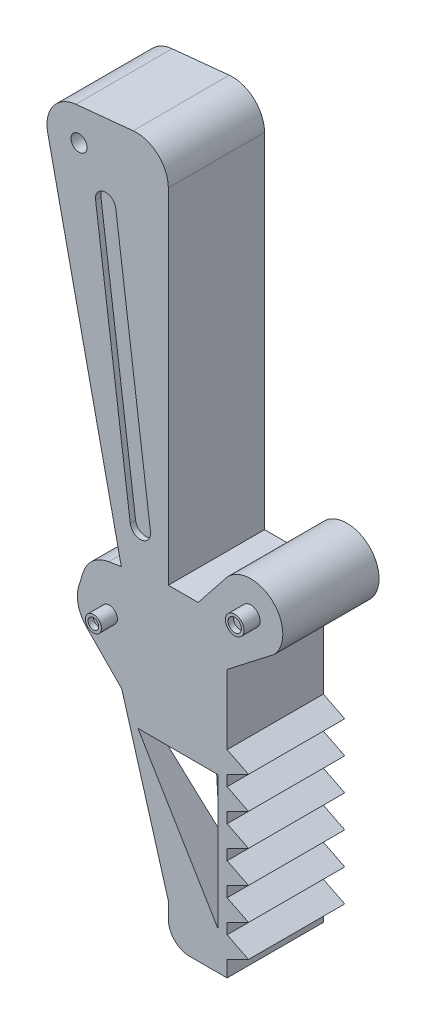
from build123d import *

# Parameters (mm, degrees)
BOSS_EXTRUDE1_DEPTH     = 18
FILLET1_R               = 6
FILLET2_R               = 6
FILLET3_R               = 4
BOSS_EXTRUDE2_DEPTH     = 18
LPATTERN1_COUNT         = 6
LPATTERN1_PITCH         = 6
CUT_EXTRUDE1_DEPTH      = 24
CUT_EXTRUDE2_DEPTH      = 7
CUT_EXTRUDE3_DEPTH      = 1
CUT_EXTRUDE3_DEPTH_BACK = 24
SKETCH5_R               = 1.5
SKETCH6_R               = 1.5
SKETCH6_R_2             = 1.75
BOSS_EXTRUDE3_DEPTH     = 3
SKETCH7_R               = 1
CUT_EXTRUDE4_DEPTH      = 1
SKETCH8_R               = 1.25
CUT_EXTRUDE5_DEPTH      = 1
CUT_EXTRUDE6_DEPTH      = 1


with BuildPart() as part:
    # Sketch1 → Boss-Extrude1 (new body)
    with BuildSketch(Plane.XY):
        Polygon((0, -71), (-8.794264851, -72.38913139), (-24, -2.38913139), (0, 0), align=None)
        with BuildLine():
            ThreePointArc((11, -64.173420673), (19.477467135, -63.809345165), (19.841542643, -72.2868123))
            Line((19.841542643, -72.2868123), (11, -79.141297469))
            Line((11, -79.141297469), (11, -129.141297469))
            Line((11, -129.141297469), (0, -129.141297469))
            Line((0, -129.141297469), (0, -122.141297469))
            Line((0, -122.141297469), (-8.711760915, -92.141297469))
            Line((-8.711760915, -92.141297469), (-17.830063901, -82.875416472))
            Line((-17.830063901, -82.875416472), (-14.816298261, -73.340364471))
            Line((-14.816298261, -73.340364471), (-8.794264851, -72.38913139))
            Line((-8.794264851, -72.38913139), (0, -71))
            Line((0, -71), (5.584872413, -71))
            Line((5.584872413, -71), (11, -64.173420673))
        make_face()
    extrude(amount=BOSS_EXTRUDE1_DEPTH)

    # Fillet1
    fillet1_edges = [part.edges().sort_by_distance(p)[0] for p in [
        (-24, -2.38913139, 9),
        (0, 0, 9),
    ]]
    fillet(fillet1_edges, radius=FILLET1_R)

    # Fillet2
    fillet2_edges = [part.edges().sort_by_distance(p)[0] for p in [
        (-17.830063901, -82.875416472, 9),
        (-14.816298261, -73.340364471, 9),
    ]]
    fillet(fillet2_edges, radius=FILLET2_R)

    # Fillet3
    fillet3_edges = [part.edges().sort_by_distance(p)[0] for p in [
        (0, -129.141297469, 9),
    ]]
    fillet(fillet3_edges, radius=FILLET3_R)

    # Sketch2 → Boss-Extrude2 (add)
    with BuildSketch(Plane(origin=(0, 0, 0), x_dir=(-1, 0, 0), z_dir=(0, 0, -1))):
        Polygon((-11, -126.141297469), (-11, -122.141297469), (-15, -124.141297469), align=None)
    boss_extrude2 = extrude(amount=-BOSS_EXTRUDE2_DEPTH)

    # LPattern1: Boss-Extrude2 ×6
    with Locations(*[(0, i * LPATTERN1_PITCH, 0) for i in range(1, LPATTERN1_COUNT)]):
        add(boss_extrude2)

    # Sketch3 → Cut-Extrude1 (cut)
    with BuildSketch(Plane.XY.offset(18)):
        Polygon((9.307447599, -122.0415562), (9.307447599, -97.0415562), (-5.692552401, -97.0415562), align=None)
    extrude(amount=-CUT_EXTRUDE1_DEPTH, mode=Mode.SUBTRACT)

    # Sketch4 → Cut-Extrude2 (cut)
    with BuildSketch(Plane(origin=(-32.710466491, -9.498858783, 0), x_dir=(0, 0, 1), z_dir=(-0.9603283669964562, -0.2788717044483353, 0))):
        Polygon((3, -93.056438116), (15, -93.056438116), (11, -112.295752741), (7, -112.295752741), align=None)
    extrude(amount=-CUT_EXTRUDE2_DEPTH, mode=Mode.SUBTRACT)

    # Sketch5 → Cut-Extrude3 (cut, two sides: drawn at the far end of the back side and taken through both)
    with BuildSketch(Plane.XY.offset(18).offset(-CUT_EXTRUDE3_DEPTH_BACK)):
        with Locations((-16.707964916, -7.692885756)):
            Circle(SKETCH5_R)
    extrude(amount=CUT_EXTRUDE3_DEPTH + CUT_EXTRUDE3_DEPTH_BACK, mode=Mode.SUBTRACT)

    # Sketch6 → Boss-Extrude3 (add)
    with BuildSketch(Plane.XY.offset(18)):
        with Locations((-11.020793941, -81.240669864)):
            Circle(SKETCH6_R)
        with Locations((15.420771321, -68.230116487)):
            Circle(SKETCH6_R_2)
    boss_extrude3 = extrude(amount=BOSS_EXTRUDE3_DEPTH)

    # Sketch7 → Cut-Extrude4 (cut)
    with BuildSketch(Plane.XY.offset(21)):
        with Locations((-11.020793941, -81.240669864)):
            Circle(SKETCH7_R)
    cut_extrude4 = extrude(amount=-CUT_EXTRUDE4_DEPTH, mode=Mode.SUBTRACT)

    # Sketch8 → Cut-Extrude5 (cut)
    with BuildSketch(Plane.XY.offset(21)):
        with Locations((15.420771321, -68.230116487)):
            Circle(SKETCH8_R)
    cut_extrude5 = extrude(amount=-CUT_EXTRUDE5_DEPTH, mode=Mode.SUBTRACT)

    # Sketch9 → Cut-Extrude6 (cut)
    with BuildSketch(Plane.XY.offset(18)):
        with BuildLine():
            Line((-9.828696114, -14.861442572), (-3.336598594, -64.043999546))
            ThreePointArc((-3.336598594, -64.043999546), (-4.98006279, -66.187319211), (-7.123382455, -64.543855015))
            Line((-7.123382455, -64.543855015), (-13.615479975, -15.361298042))
            ThreePointArc((-13.615479975, -15.361298042), (-11.97201578, -13.217978377), (-9.828696114, -14.861442572))
        make_face()
    cut_extrude6 = extrude(amount=-CUT_EXTRUDE6_DEPTH, mode=Mode.SUBTRACT)

    # Mirror1: Boss-Extrude3, Cut-Extrude4, Cut-Extrude5, Cut-Extrude6 across plane
    add(boss_extrude3.mirror(Plane.XY.offset(9)))
    add(cut_extrude4.mirror(Plane.XY.offset(9)), mode=Mode.SUBTRACT)
    add(cut_extrude5.mirror(Plane.XY.offset(9)), mode=Mode.SUBTRACT)
    add(cut_extrude6.mirror(Plane.XY.offset(9)), mode=Mode.SUBTRACT)


solid = part.part
